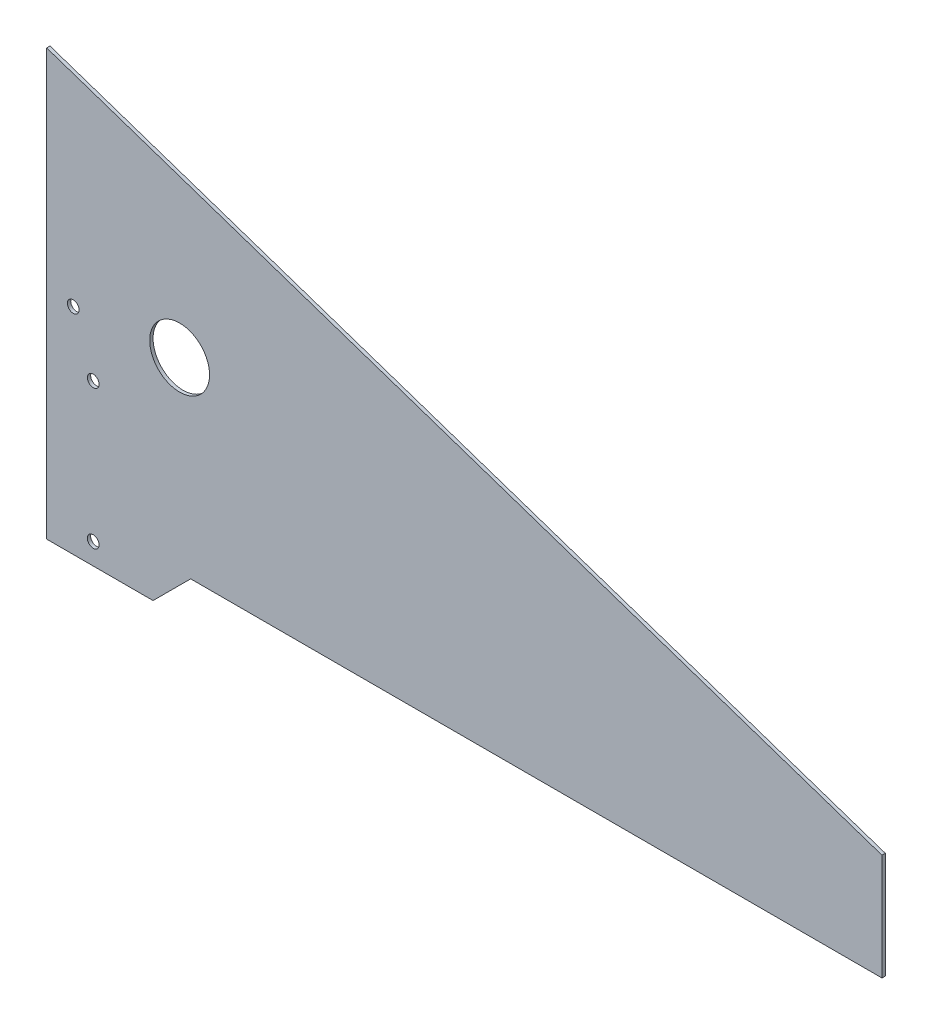
from build123d import *

# Parameters (mm, degrees)
BOSS_EXTRUDE1_DEPTH    = 1.5875
F_10_CLEARANCE_HOLE1_D = 5.6134
SKETCH5_R              = 14.2875
CUT_EXTRUDE1_DEPTH     = 448.730108977


with BuildPart() as part:
    # Sketch1 → Boss-Extrude1 (new body)
    with BuildSketch(Plane.XY):
        Polygon((0, 0), (0, 203.2), (398.960512242, 68.760512242), (398.960512242, 17.960512242), (68.760512242, 17.960512242), (50.8, 0), align=None)
    extrude(amount=BOSS_EXTRUDE1_DEPTH)

    # #10 Clearance Hole1 (through all)
    with Locations(Plane(origin=(0, 0, 0), x_dir=(-1, 0, 0), z_dir=(0, 0, -1))):
        with Locations((-12.7, 102.542512242), (-22.225, 76.573552108), (-22.225, 10.147472376)):
            Hole(F_10_CLEARANCE_HOLE1_D / 2)

    # Sketch5 → Cut-Extrude1 (cut, through all)
    with BuildSketch(Plane.XY.offset(1.5875)):
        with Locations((63.5, 106.860512242)):
            Circle(SKETCH5_R)
    extrude(amount=-CUT_EXTRUDE1_DEPTH, mode=Mode.SUBTRACT)


solid = part.part
